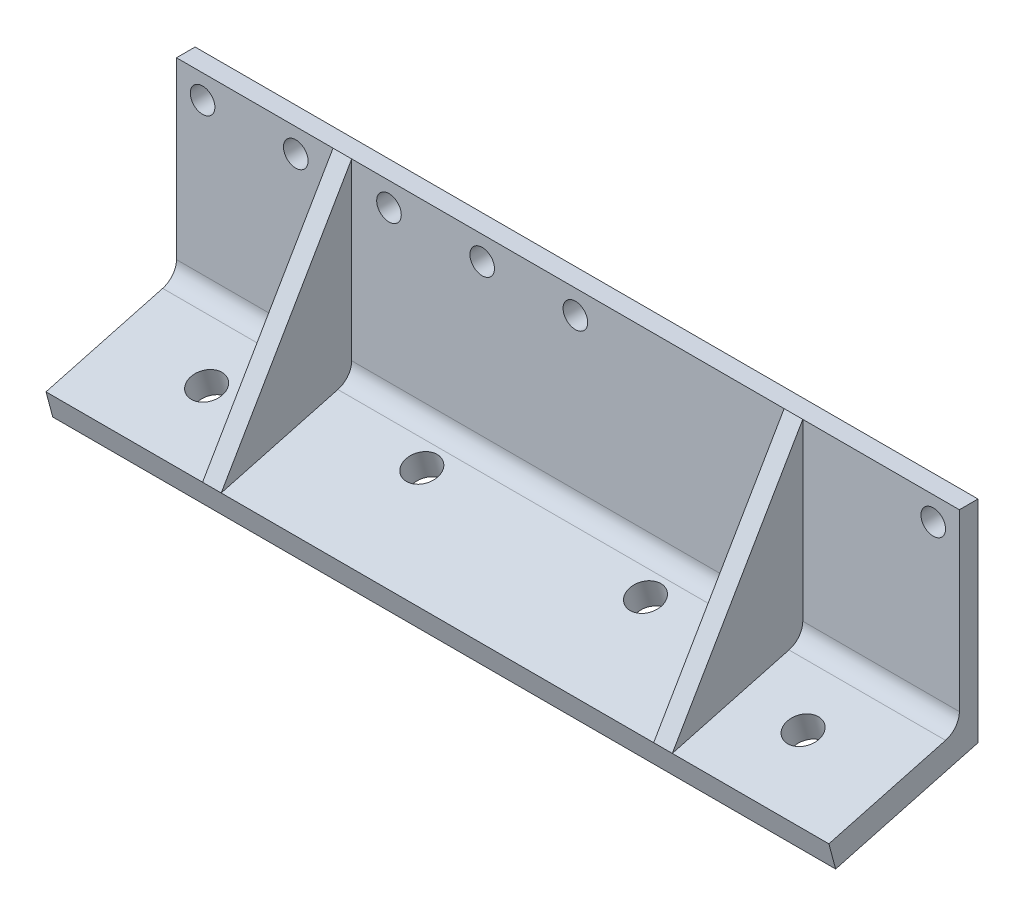
from build123d import *

# Parameters (mm, degrees)
EXTRUDE_1_DEPTH      = 30
SKETCH_2_R           = 44.45
CUT_EXTRUDE_1_DEPTH  = 4
SKETCH_3_R           = 25.5
SKETCH_3_R_2         = 2.25
CUT_EXTRUDE_2_DEPTH  = 188.619295383
CUT_EXTRUDE_3_DEPTH  = 189.215302247
SKETCH_5_R           = 1.65
CUT_EXTRUDE_4_DEPTH  = 189.215302247
EXTRUDE_START        = -30
EXTRUDE_2_DEPTH      = 30
CUT_EXTRUDE_5_DEPTH  = 198.040604952
CUT_EXTRUDE_7_DEPTH  = 233.432785983
CUT_EXTRUDE_8_DEPTH  = 233.432785983
CUT_EXTRUDE_9_DEPTH  = 233.432785983
FILLET_1_R           = 5
CUT_EXTRUDE_10_DEPTH = 233.432785983
EXTRUDE_START_2      = -5
EXTRUDE_3_DEPTH      = 5
EXTRUDE_4_DEPTH      = 5
SKETCH_14_R          = 4.25
CUT_EXTRUDE_11_DEPTH = 189.364728478
SKETCH_16_W          = 43
SKETCH_16_H          = 30
CUT_EXTRUDE_12_DEPTH = 233.432785983
EXTRUDE_7_REACH      = 188.592
SKETCH_18_W          = 210
SKETCH_18_H          = 5
EXTRUDE_8_DEPTH      = 210
EXTRUDE_9_DEPTH      = 5
EXTRUDE_10_DEPTH     = 5
SKETCH_22_R          = 4.25
CUT_EXTRUDE_13_DEPTH = 187.984035343
FILLET_2_R           = 5
SKETCH_23_W          = 158.512158041
SKETCH_23_H          = 103.317713915
CUT_EXTRUDE_14_DEPTH = 234.418610938
EXTRUDE_11_DEPTH     = 2.5
EXTRUDE_12_DEPTH     = 2.5
CUT_EXTRUDE_15_DEPTH = 5
CUT_EXTRUDE_START    = -5
CUT_EXTRUDE_16_DEPTH = 5
SKETCH_24_R          = 3.3
CUT_EXTRUDE_17_DEPTH = 166.976648756


with BuildPart() as part:
    # 草图1 → 凸台-拉伸1 (new body)
    with BuildSketch(Plane(origin=(0, 0, 0), x_dir=(1, 0, 0), z_dir=(0, 1, 0))):
        with BuildLine():
            Line((170, 31.93), (170, -31.93))
            ThreePointArc((170, -31.93), (167.781993847, -38.210172909), (162.111885646, -41.704453387))
            Line((162.111885646, -41.704453387), (15.839142344, -73.308400404))
            ThreePointArc((15.839142344, -73.308400404), (-75, 0), (15.839142344, 73.308400404))
            Line((15.839142344, 73.308400404), (162.111885646, 41.704453387))
            ThreePointArc((162.111885646, 41.704453387), (167.781993847, 38.210172909), (170, 31.93))
        make_face()
    extrude(amount=EXTRUDE_1_DEPTH)

    # 草图2 → 切除-拉伸1 (cut)
    with BuildSketch(Plane(origin=(0, 30, 0), x_dir=(1, 0, 0), z_dir=(0, 1, 0))):
        with Locations(Location((0, 0, 0), (0, 0, 270))):
            Circle(SKETCH_2_R)
    extrude(amount=-CUT_EXTRUDE_1_DEPTH, mode=Mode.SUBTRACT)

    # 草图3 → 切除-拉伸2 (cut, through all)
    with BuildSketch(Plane(origin=(0, 26, 0), x_dir=(1, 0, 0), z_dir=(0, 1, 0))):
        with Locations(Location((0, 0, 0), (0, 0, 270))):
            Circle(SKETCH_3_R)
        with Locations(Location((0, 41, 0), (0, 0, 270))):
            Circle(SKETCH_3_R_2)
        with Locations(Location((28.991378029, 28.991378029, 0), (0, 0, 270))):
            Circle(SKETCH_3_R_2)
        with Locations(Location((41, 0, 0), (0, 0, 270))):
            Circle(SKETCH_3_R_2)
        with Locations(Location((28.991378029, -28.991378029, 0), (0, 0, 270))):
            Circle(SKETCH_3_R_2)
        with Locations(Location((0, -41, 0), (0, 0, 270))):
            Circle(SKETCH_3_R_2)
        with Locations(Location((-28.991378029, -28.991378029, 0), (0, 0, 270))):
            Circle(SKETCH_3_R_2)
        with Locations(Location((-41, 0, 0), (0, 0, 270))):
            Circle(SKETCH_3_R_2)
        with Locations(Location((-28.991378029, 28.991378029, 0), (0, 0, 270))):
            Circle(SKETCH_3_R_2)
    extrude(amount=-CUT_EXTRUDE_2_DEPTH, mode=Mode.SUBTRACT)

    # 草图4 → 切除-拉伸3 (cut, through all)
    with BuildSketch(Plane(origin=(0, 30, 0), x_dir=(1, 0, 0), z_dir=(0, 1, 0))):
        with BuildLine():
            Line((124, 18.5), (134, 18.5))
            ThreePointArc((134, 18.5), (152.5, 0), (134, -18.5))
            Line((134, -18.5), (124, -18.5))
            ThreePointArc((124, -18.5), (105.5, 0), (124, 18.5))
        make_face()
    extrude(amount=-CUT_EXTRUDE_3_DEPTH, mode=Mode.SUBTRACT)

    # 草图5 → 切除-拉伸4 (cut, through all)
    with BuildSketch(Plane(origin=(0, 30, 0), x_dir=(1, 0, 0), z_dir=(0, 1, 0))):
        with Locations(Location((116.75, 25.5, 0), (0, 0, 270))):
            Circle(SKETCH_5_R)
        with Locations(Location((141.25, 25.5, 0), (0, 0, 270))):
            Circle(SKETCH_5_R)
        with Locations(Location((141.25, -25.5, 0), (0, 0, 270))):
            Circle(SKETCH_5_R)
        with Locations(Location((116.75, -25.5, 0), (0, 0, 270))):
            Circle(SKETCH_5_R)
    extrude(amount=-CUT_EXTRUDE_4_DEPTH, mode=Mode.SUBTRACT)

    # 草图6 → 凸台-拉伸2 (add)
    with BuildSketch(Plane(origin=(0, 30, 0), x_dir=(1, 0, 0), z_dir=(0, 1, 0)).offset(EXTRUDE_START)):
        with BuildLine():
            Line((158, 95), (-52, 95))
            Line((-52, 95), (-52, 54.046276467))
            ThreePointArc((-52, 54.046276467), (-20.48558667, 72.148047366), (15.839142344, 73.308400404))
            Line((15.839142344, 73.308400404), (158, 42.592874655))
            Line((158, 42.592874655), (158, 95))
        make_face()
        with BuildLine():
            ThreePointArc((15.839142344, -73.308400404), (-20.48558667, -72.148047366), (-52, -54.046276467))
            Line((-52, -54.046276467), (-52, -95))
            Line((-52, -95), (158, -95))
            Line((158, -95), (158, -42.592874655))
            Line((158, -42.592874655), (15.839142344, -73.308400404))
        make_face()
    extrude(amount=EXTRUDE_2_DEPTH)

    # 草图7 → 切除-拉伸5 (cut, through all)
    with BuildSketch(Plane(origin=(0, 30, 0), x_dir=(1, 0, 0), z_dir=(0, 1, 0))):
        with BuildLine():
            Line((-52, 54.046276467), (-52, -54.046276467))
            ThreePointArc((-52, -54.046276467), (-75, 0), (-52, 54.046276467))
        make_face()
        with BuildLine():
            Line((158, 42.592874655), (158, -42.592874655))
            Line((158, -42.592874655), (162.111885646, -41.704453387))
            ThreePointArc((162.111885646, -41.704453387), (167.781993847, -38.210172909), (170, -31.93))
            Line((170, -31.93), (170, 31.93))
            ThreePointArc((170, 31.93), (167.781993847, 38.210172909), (162.111885646, 41.704453387))
            Line((162.111885646, 41.704453387), (158, 42.592874655))
        make_face()
    extrude(amount=-CUT_EXTRUDE_5_DEPTH, mode=Mode.SUBTRACT)

    # 草图9 → 切除-拉伸7 (cut, through all)
    with BuildSketch(Plane.ZY.offset(52)):
        Polygon((-95, 20), (-60, 10.621778265), (-60, 30), (-95, 30), align=None)
    extrude(amount=-CUT_EXTRUDE_7_DEPTH, mode=Mode.SUBTRACT)

    # 草图10 → 切除-拉伸8 (cut, through all)
    with BuildSketch(Plane.ZY.offset(52)):
        Polygon((-95, 12.753066737), (-52, 1.231251463), (-52, 0), (-95, 0), align=None)
    extrude(amount=-CUT_EXTRUDE_8_DEPTH, mode=Mode.SUBTRACT)

    # 草图8 → 切除-拉伸9 (cut, through all)
    with BuildSketch(Plane.ZY.offset(52)):
        Polygon((0, 0), (52, 0), (52, 17.3), (-52, 17.3), (-52, 0), align=None)
    extrude(amount=-CUT_EXTRUDE_9_DEPTH, mode=Mode.SUBTRACT)

    # 圆角1
    fillet_1_edges = [part.edges().sort_by_distance(p)[0] for p in [
        (53, 10.621778265, -60),
    ]]
    fillet(fillet_1_edges, radius=FILLET_1_R)

    # 草图11 → 切除-拉伸10 (cut, through all)
    with BuildSketch(Plane.ZY.offset(52)):
        Polygon((-95, 12.753066737), (-93.188266684, 19.514547521), (-95, 20), align=None)
    extrude(amount=-CUT_EXTRUDE_10_DEPTH, mode=Mode.SUBTRACT)

    # 草图12 → 凸台-拉伸3 (add)
    with BuildSketch(Plane.ZY.offset(52).offset(EXTRUDE_START_2)):
        with BuildLine():
            Line((-93.188266684, 19.514547521), (-60, 30))
            Line((-60, 30), (-60, 17.137905129))
            ThreePointArc((-60, 17.137905129), (-61.956192855, 13.171138428), (-66.294095226, 12.308275998))
            Line((-66.294095226, 12.308275998), (-93.188266684, 19.514547521))
        make_face()
    extrude(amount=EXTRUDE_3_DEPTH)

    # 草图13 → 凸台-拉伸4 (add)
    with BuildSketch(Plane(origin=(158, 0, 0), x_dir=(0, 0, -1), z_dir=(1, 0, 0))):
        with BuildLine():
            Line((66.294095226, 12.308275998), (93.188266684, 19.514547521))
            Line((93.188266684, 19.514547521), (60, 30))
            Line((60, 30), (60, 17.137905129))
            ThreePointArc((60, 17.137905129), (61.956192855, 13.171138428), (66.294095226, 12.308275998))
        make_face()
    extrude(amount=-EXTRUDE_4_DEPTH)

    # 草图14 → 切除-拉伸11 (cut, through all)
    with BuildSketch(Plane(origin=(0, -5.089745962, -1.36379332), x_dir=(1, 0, 0), z_dir=(0, 0.9659258262890681, 0.2588190451025214))):
        with Locations(Location((-27, 82.063690052, 0), (0, 0, 270))):
            Circle(SKETCH_14_R)
        with Locations(Location((23, 82.063690052, 0), (0, 0, 270))):
            Circle(SKETCH_14_R)
        with Locations(Location((83, 82.063690052, 0), (0, 0, 270))):
            Circle(SKETCH_14_R)
        with Locations(Location((133, 82.063690052, 0), (0, 0, 270))):
            Circle(SKETCH_14_R)
    extrude(amount=-CUT_EXTRUDE_11_DEPTH, mode=Mode.SUBTRACT)

    # 草图16 → 切除-拉伸12 (cut, through all)
    with BuildSketch(Plane.ZY.offset(52)):
        with Locations((73.5, 15)):
            Rectangle(SKETCH_16_W, SKETCH_16_H)
    extrude(amount=-CUT_EXTRUDE_12_DEPTH, mode=Mode.SUBTRACT)

    # 凸台-拉伸7: up to this plane
    extrude_7_end = Plane(origin=(0, -11.851226746, -3.175526636), z_dir=(0, -0.9659258262890681, -0.25881904510252146))
    # 草图18 → 凸台-拉伸7 (add, up to the surface)
    with BuildSketch(Plane(origin=(0, 30, 0), x_dir=(1, 0, 0), z_dir=(0, 1, 0)), mode=Mode.PRIVATE) as extrude_7_sk1:
        with Locations((53, -54.5)):
            Rectangle(SKETCH_18_W, SKETCH_18_H)
    extrude_7_tool1 = split(extrude(extrude_7_sk1.sketch, amount=-EXTRUDE_7_REACH, mode=Mode.PRIVATE), bisect_by=extrude_7_end, keep=Keep.BOTH, mode=Mode.PRIVATE)
    add(extrude_7_tool1.solids().sort_by_distance((53, 30, 54.5))[0])

    # 草图19 → 凸台-拉伸8 (add)
    with BuildSketch(Plane.ZY.offset(52)):
        Polygon((57, -27.975210512), (90.188266684, -36.867979769), (92, -30.106498985), (57, -20.72827725), align=None)
    extrude(amount=-EXTRUDE_8_DEPTH)

    # 草图20 → 凸台-拉伸9 (add)
    with BuildSketch(Plane.ZY.offset(52)):
        Polygon((92, -30.106498985), (57, -20.72827725), (57, 30), align=None)
    extrude(amount=-EXTRUDE_9_DEPTH)

    # 草图21 → 凸台-拉伸10 (add)
    with BuildSketch(Plane(origin=(158, 0, 0), x_dir=(0, 0, -1), z_dir=(1, 0, 0))):
        Polygon((-57, 30), (-92, -30.106498985), (-57, -20.72827725), align=None)
    extrude(amount=-EXTRUDE_10_DEPTH)

    # 草图22 → 切除-拉伸13 (cut, through all)
    with BuildSketch(Plane(origin=(0, -5.089745962, -1.36379332), x_dir=(1, 0, 0), z_dir=(0, 0.9659258262890686, 0.25881904510251946))):
        with Locations(Location((-27, -77.936309948, 0), (0, 0, 270))):
            Circle(SKETCH_22_R)
        with Locations(Location((23, -69.936309948, 0), (0, 0, 270))):
            Circle(SKETCH_22_R)
        with Locations(Location((83, -69.936309948, 0), (0, 0, 270))):
            Circle(SKETCH_22_R)
        with Locations(Location((133, -77.936309948, 0), (0, 0, 270))):
            Circle(SKETCH_22_R)
    extrude(amount=-CUT_EXTRUDE_13_DEPTH, mode=Mode.SUBTRACT)

    # 圆角2
    fillet_2_edges = [part.edges().sort_by_distance(p)[0] for p in [
        (53, -20.72827725, 57),
    ]]
    fillet(fillet_2_edges, radius=FILLET_2_R)

    # 草图23 → 切除-拉伸14 (cut, through all)
    with BuildSketch(Plane.ZY.offset(52)):
        with Locations((-27.256079021, 5.306767281)):
            Rectangle(SKETCH_23_W, SKETCH_23_H)
    extrude(amount=-CUT_EXTRUDE_14_DEPTH, mode=Mode.SUBTRACT)

    # 草图25 → 凸台-拉伸11 (add, symmetric)
    with BuildSketch(Plane.ZY.offset(7.5)):
        with BuildLine():
            Line((60.705904774, -21.721271441), (92, -30.106498985))
            Line((92, -30.106498985), (57, 30))
            Line((57, 30), (57, -16.89164231))
            ThreePointArc((57, -16.89164231), (58.033233299, -19.935449455), (60.705904774, -21.721271441))
        make_face()
    extrude(amount=EXTRUDE_11_DEPTH, both=True)

    # 草图26 → 凸台-拉伸12 (add, symmetric)
    with BuildSketch(Plane(origin=(113.5, 0, 0), x_dir=(0, 0, -1), z_dir=(1, 0, 0))):
        with BuildLine():
            Line((-57, -16.89164231), (-57, 30))
            Line((-57, 30), (-92, -30.106498985))
            Line((-92, -30.106498985), (-60.705904774, -21.721271441))
            ThreePointArc((-60.705904774, -21.721271441), (-58.033233299, -19.935449455), (-57, -16.89164231))
        make_face()
    extrude(amount=EXTRUDE_12_DEPTH, both=True)

    # 草图27 → 切除-拉伸15 (cut)
    with BuildSketch(Plane(origin=(-47, 0, 0), x_dir=(0, 0, -1), z_dir=(1, 0, 0))):
        with BuildLine():
            Line((-92, -30.106498985), (-60.705904774, -21.721271441))
            ThreePointArc((-60.705904774, -21.721271441), (-58.033233299, -19.935449455), (-57, -16.89164231))
            Line((-57, -16.89164231), (-57, 30))
            Line((-57, 30), (-92, -30.106498985))
        make_face()
    extrude(amount=-CUT_EXTRUDE_15_DEPTH, mode=Mode.SUBTRACT)

    # 草图28 → 切除-拉伸16 (cut)
    with BuildSketch(Plane.ZY.offset(-153).offset(CUT_EXTRUDE_START)):
        with BuildLine():
            Line((57, 30), (57, -16.89164231))
            ThreePointArc((57, -16.89164231), (58.033233299, -19.935449455), (60.705904774, -21.721271441))
            Line((60.705904774, -21.721271441), (92, -30.106498985))
            Line((92, -30.106498985), (57, 30))
        make_face()
    extrude(amount=CUT_EXTRUDE_16_DEPTH, mode=Mode.SUBTRACT)

    # 草图24 → 切除-拉伸17 (cut, through all)
    with BuildSketch(Plane.XY.offset(57)):
        with Locations((-45, 23.65)):
            Circle(SKETCH_24_R)
        with Locations((151, 23.65)):
            Circle(SKETCH_24_R)
        with Locations((55, 23.65)):
            Circle(SKETCH_24_R)
        with Locations((30, 23.65)):
            Circle(SKETCH_24_R)
        with Locations((5, 23.65)):
            Circle(SKETCH_24_R)
        with Locations((-20, 23.65)):
            Circle(SKETCH_24_R)
    extrude(amount=-CUT_EXTRUDE_17_DEPTH, mode=Mode.SUBTRACT)


solid = part.part
